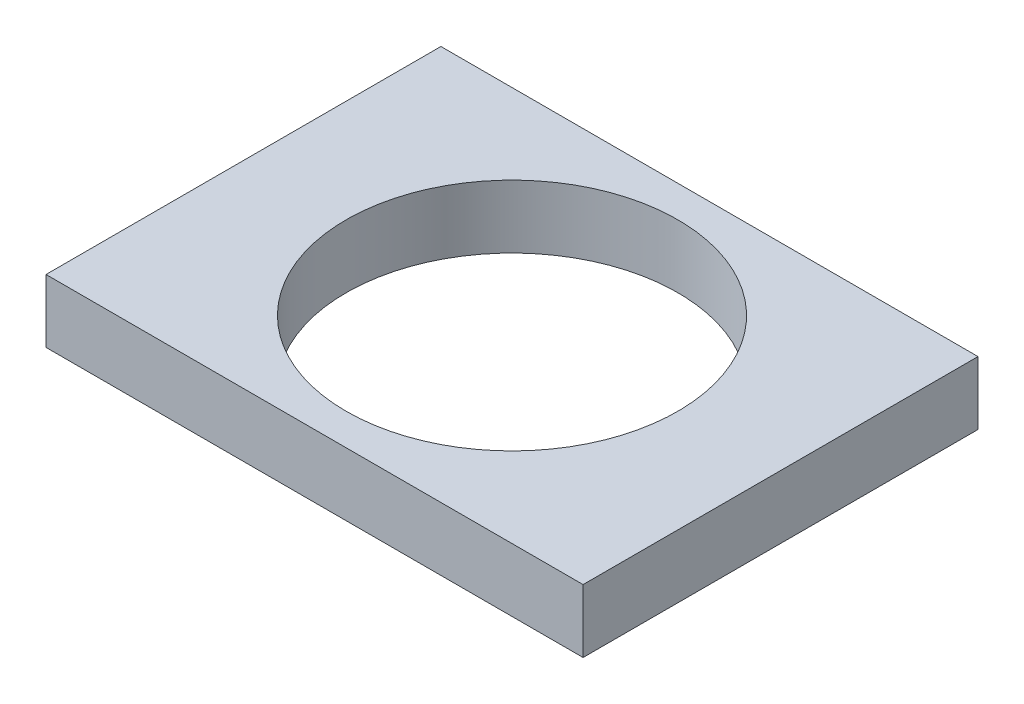
from build123d import *

# Parameters (mm, degrees)
SKETCH1_W           = 170
SKETCH1_H           = 125
SKETCH1_R           = 52.5
BOSS_EXTRUDE1_DEPTH = 20


with BuildPart() as part:
    # Sketch1 → Boss-Extrude1 (new body)
    with BuildSketch(Plane(origin=(0, 0, 0), x_dir=(1, 0, 0), z_dir=(0, 1, 0))):
        Rectangle(SKETCH1_W, SKETCH1_H)
        with Locations(Location((0, 0, 0), (0, 0, 270))):
            Circle(SKETCH1_R, mode=Mode.SUBTRACT)
    extrude(amount=BOSS_EXTRUDE1_DEPTH)


solid = part.part
